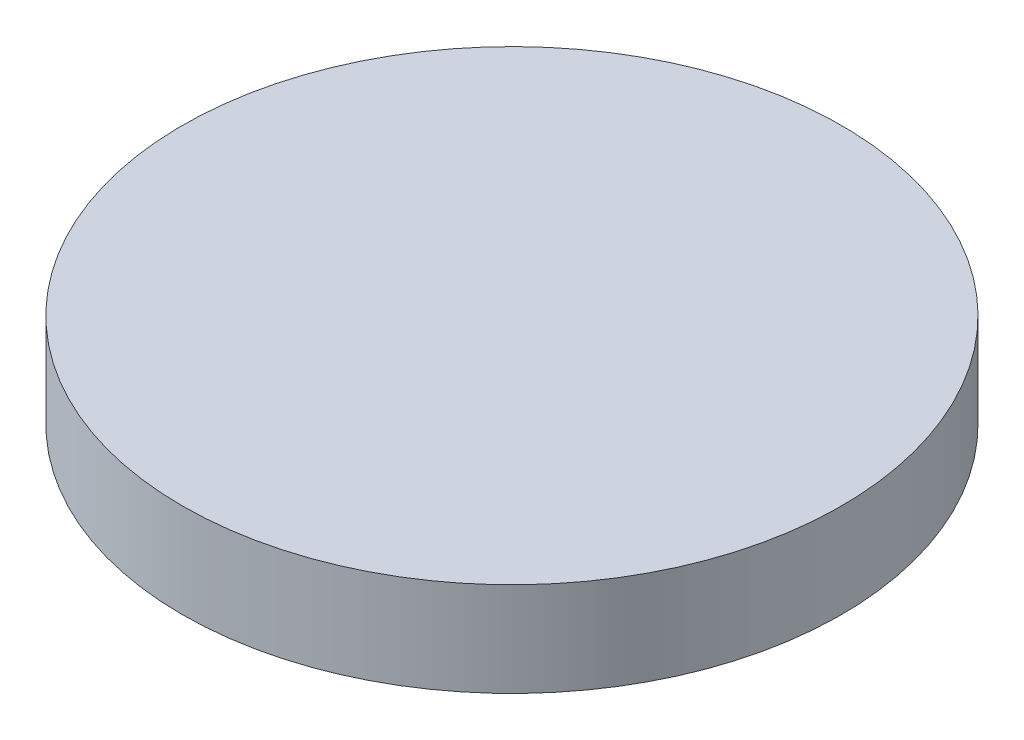
from build123d import *

# Parameters (mm, degrees)
SKETCH1_W = 1.5
SKETCH1_H = 3


with BuildPart() as part:
    # Sketch1 → Revolve1 (revolve)
    with BuildSketch(Plane(origin=(0, 0, 0), x_dir=(0, 0, -1), z_dir=(1, 0, 0)), mode=Mode.PRIVATE) as revolve1_sk:
        Polygon((10.5, 6), (0, 6), (0, 3), (3, 3), (4.5, 3), (10.5, 3), align=None)
        with Locations((3.75, 1.5)):
            Rectangle(SKETCH1_W, SKETCH1_H)
    revolve(revolve1_sk.sketch.rotate(Axis((0, 0, 0), (0, -1, 0)), 180), axis=Axis((0, 0, 0), (0, -1, 0)))


solid = part.part
